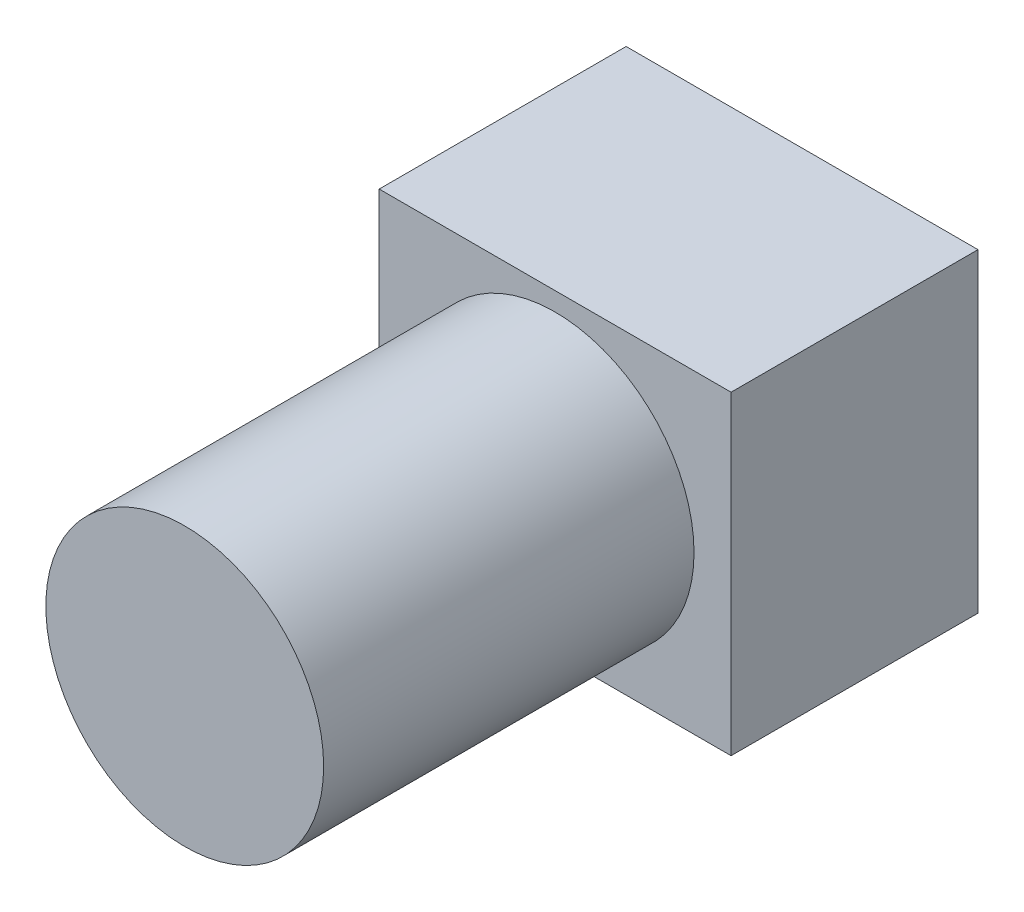
from build123d import *

# Parameters (mm, degrees)
SCHIZZO1_W                   = 5.699999879
SCHIZZO1_H                   = 5.099999898
ESTRUSIONE_ESTRUSIONE1_DEPTH = 4
SCHIZZO2_W                   = 4
SCHIZZO2_H                   = 4
TAGLIO_ESTRUSIONE1_DEPTH     = 1
SCHIZZO3_R                   = 2.25
ESTRUSIONE_ESTRUSIONE2_DEPTH = 6


with BuildPart() as part:
    # Schizzo1 → Estrusione-Estrusione1 (new body)
    with BuildSketch(Plane(origin=(0, 0, 126.00326253), x_dir=(-1, 0, 0), z_dir=(0, 0, -1))):
        with Locations((2.391212038, 37.24404717)):
            Rectangle(SCHIZZO1_W, SCHIZZO1_H)
    extrude(amount=ESTRUSIONE_ESTRUSIONE1_DEPTH)

    # Schizzo2 → Taglio-Estrusione1 (cut)
    with BuildSketch(Plane(origin=(0, 0, 122.00326253), x_dir=(-1, 0, 0), z_dir=(0, 0, -1))):
        with Locations((2.391212098, 37.244047119)):
            Rectangle(SCHIZZO2_W, SCHIZZO2_H)
    extrude(amount=-TAGLIO_ESTRUSIONE1_DEPTH, mode=Mode.SUBTRACT)

    # Schizzo3 → Estrusione-Estrusione2 (add)
    with BuildSketch(Plane.XY.offset(126.00326253)):
        with Locations((-2.391212038, 37.24404717)):
            Circle(SCHIZZO3_R)
    extrude(amount=ESTRUSIONE_ESTRUSIONE2_DEPTH)


solid = part.part
